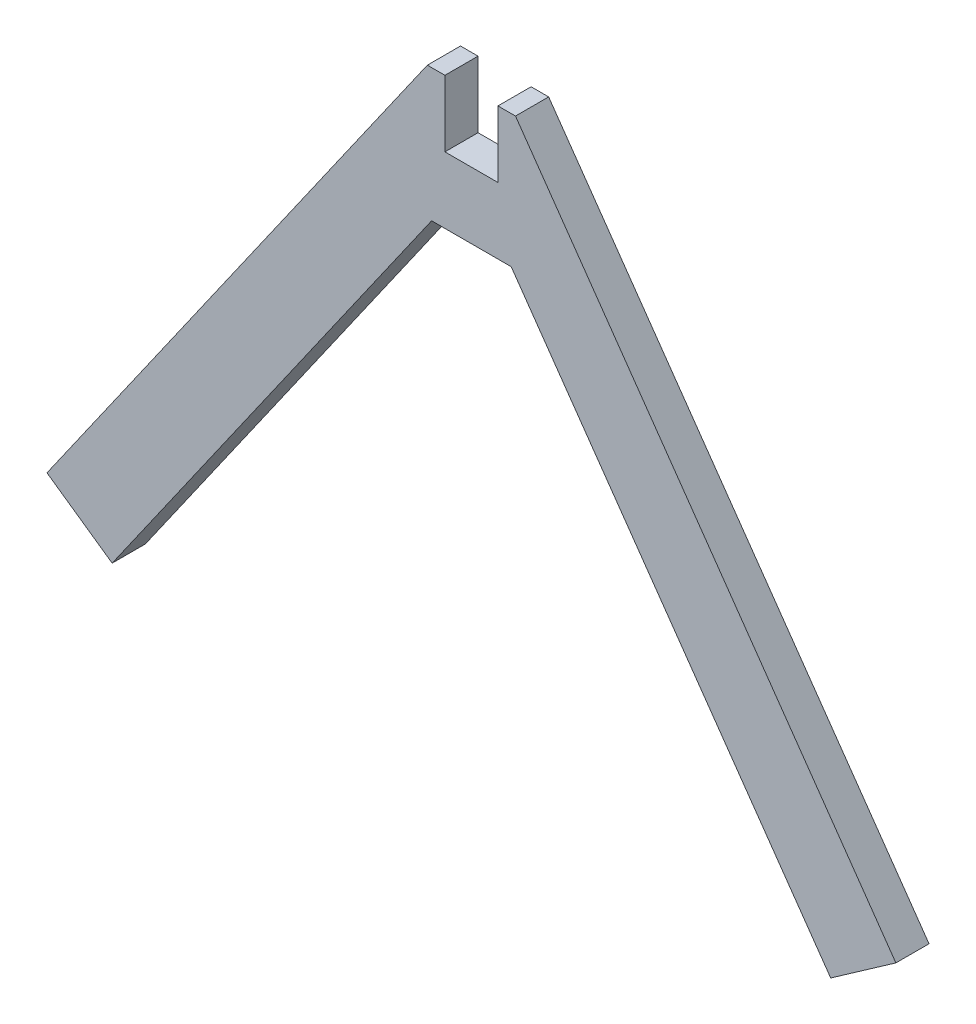
from build123d import *

# Parameters (mm, degrees)
BOSS_EXTRUDE1_DEPTH = 3.175
CUT_EXTRUDE1_REACH  = 71.579
SKETCH2_W           = 5.08
SKETCH2_H           = 6.35


with BuildPart() as part:
    # Sketch1 → Boss-Extrude1 (new body)
    with BuildSketch(Plane.XY):
        Polygon((4.219666631, 0), (-4.219666631, 0), (-40.641770339, -52.016154812), (-34.399831762, -56.386807257), (-3.81, -12.7), (3.81, -12.7), (34.399831762, -56.386807257), (40.641770339, -52.016154812), align=None)
    extrude(amount=BOSS_EXTRUDE1_DEPTH)

    # Sketch2 → Cut-Extrude1 (cut, up to next)
    with BuildSketch(Plane.XY.offset(3.175), mode=Mode.PRIVATE) as cut_extrude1_sk1:
        with Locations((0, -3.175)):
            Rectangle(SKETCH2_W, SKETCH2_H)
    cut_extrude1_tool1 = extrude(cut_extrude1_sk1.sketch, amount=-CUT_EXTRUDE1_REACH, mode=Mode.PRIVATE) & part.part
    add(cut_extrude1_tool1.solids().sort_by_distance((0, -3.175, 3.175))[0], mode=Mode.SUBTRACT)


solid = part.part
